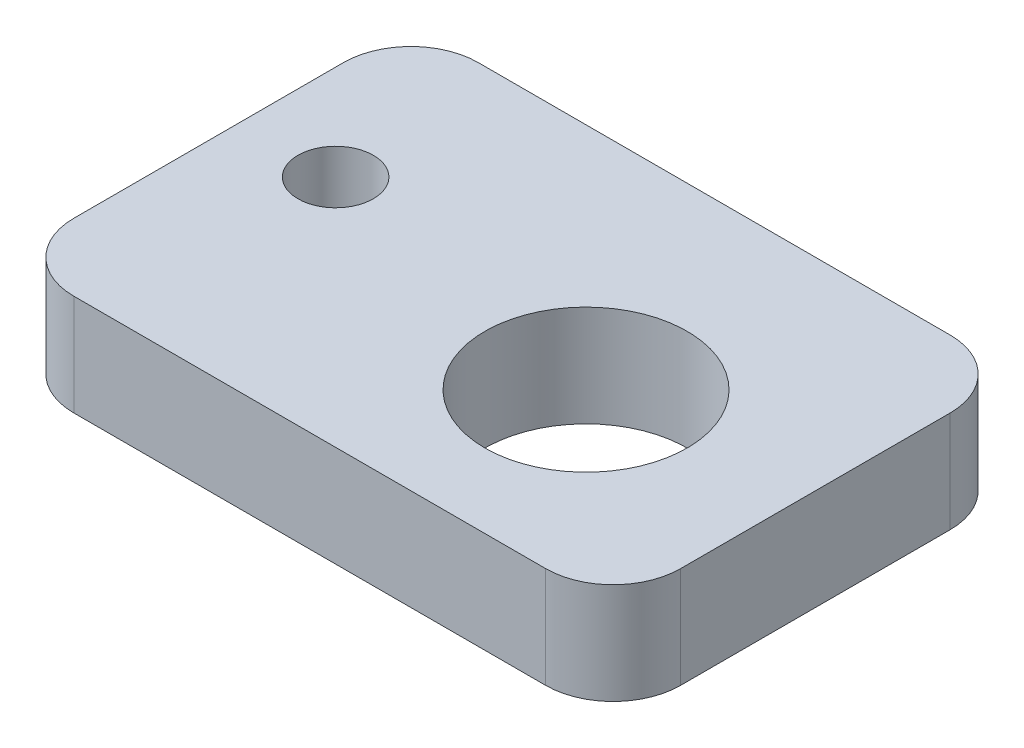
from build123d import *

# Parameters (mm, degrees)
SKETCH_1_W          = 180
SKETCH_1_H          = 120
EXTRUDE_2_DEPTH     = 30
SKETCH_3_R          = 30
SKETCH_3_R_2        = 11.186038902
CUT_EXTRUDE_1_DEPTH = 213.807433918
FILLET_1_R          = 20
SHELL_1_T           = 2


with BuildPart() as part:
    # 草图1 → 凸台-拉伸2 (new body)
    with BuildSketch(Plane(origin=(0, 0, 0), x_dir=(1, 0, 0), z_dir=(0, 1, 0))):
        with Locations((90, -49.485176763)):
            Rectangle(SKETCH_1_W, SKETCH_1_H)
    extrude(amount=EXTRUDE_2_DEPTH)

    # 草图3 → 切除-拉伸1 (cut, through all)
    with BuildSketch(Plane(origin=(0, 30, 0), x_dir=(1, 0, 0), z_dir=(0, 1, 0))):
        with Locations(Location((120, -57.523652535, 0), (0, 0, 270))):
            Circle(SKETCH_3_R)
        with Locations(Location((28.239340808, -40.043809648, 0), (0, 0, 270))):
            Circle(SKETCH_3_R_2)
    extrude(amount=-CUT_EXTRUDE_1_DEPTH, mode=Mode.SUBTRACT)

    # 圆角1
    fillet_1_edges = [part.edges().sort_by_distance(p)[0] for p in [
        (0, 15, -10.514823237),
        (180, 15, -10.514823237),
        (180, 15, 109.485176763),
        (0, 15, 109.485176763),
    ]]
    fillet(fillet_1_edges, radius=FILLET_1_R)

    # 抽壳1 (no face opened: a closed hollow body)
    add(offset(amount=-SHELL_1_T, mode=Mode.PRIVATE), mode=Mode.SUBTRACT)


solid = part.part
